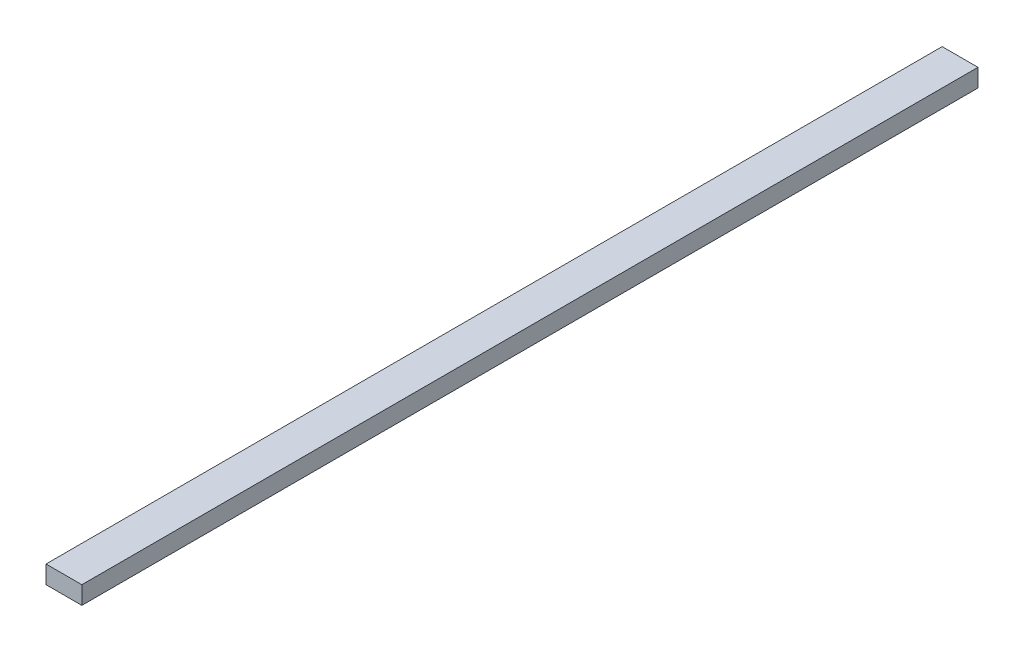
from build123d import *

# Parameters (mm, degrees)
SKETCH1_W           = 20
SKETCH1_H           = 10
BOSS_EXTRUDE1_DEPTH = 500


with BuildPart() as part:
    # Sketch1 → Boss-Extrude1 (new body)
    with BuildSketch(Plane.XY):
        Rectangle(SKETCH1_W, SKETCH1_H)
    extrude(amount=BOSS_EXTRUDE1_DEPTH)


solid = part.part
